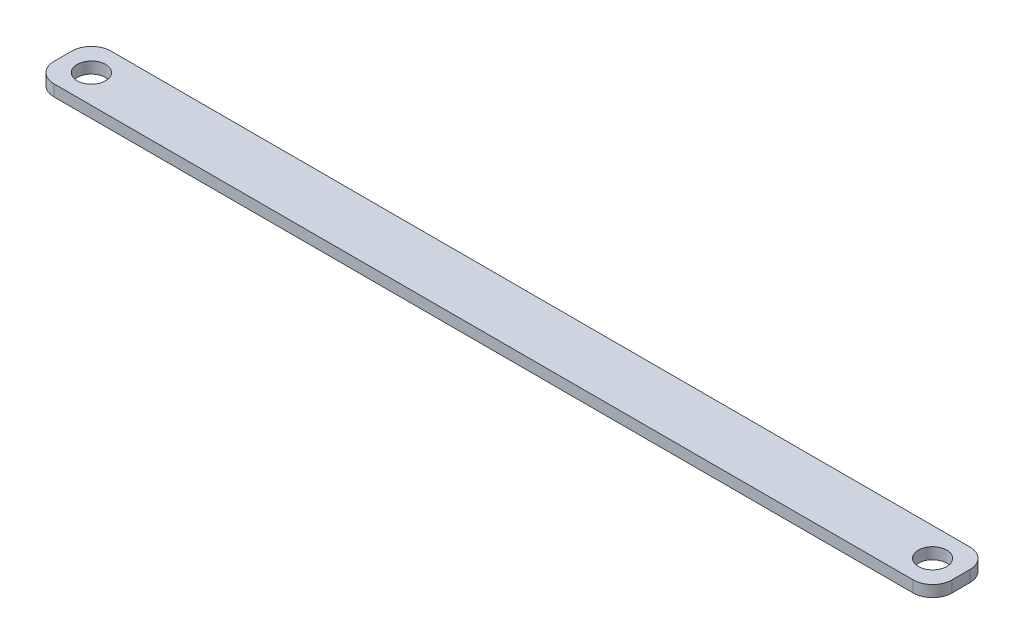
from build123d import *

# Parameters (mm, degrees)
SKETCH1_R           = 12.5
BOSS_EXTRUDE1_DEPTH = 10


with BuildPart() as part:
    # Sketch1 → Boss-Extrude1 (new body)
    with BuildSketch(Plane(origin=(0, 0, 0), x_dir=(1, 0, 0), z_dir=(0, 1, 0))):
        with BuildLine():
            Line((-17.11126668, 0), (-772.88873332, 0))
            ThreePointArc((-772.88873332, 0), (-784.988226024, -5.011773976), (-790, -17.11126668))
            Line((-790, -17.11126668), (-790, -32.88873332))
            ThreePointArc((-790, -32.88873332), (-784.988226024, -44.988226024), (-772.88873332, -50))
            Line((-772.88873332, -50), (-17.11126668, -50))
            ThreePointArc((-17.11126668, -50), (-5.011773976, -44.988226024), (0, -32.88873332))
            Line((0, -32.88873332), (0, -17.11126668))
            ThreePointArc((0, -17.11126668), (-5.011773976, -5.011773976), (-17.11126668, 0))
        make_face()
        with Locations(Location((-765, -25, 0), (0, 0, 270))):
            Circle(SKETCH1_R, mode=Mode.SUBTRACT)
        with Locations(Location((-25, -25, 0), (0, 0, 270))):
            Circle(SKETCH1_R, mode=Mode.SUBTRACT)
    extrude(amount=BOSS_EXTRUDE1_DEPTH)


solid = part.part
